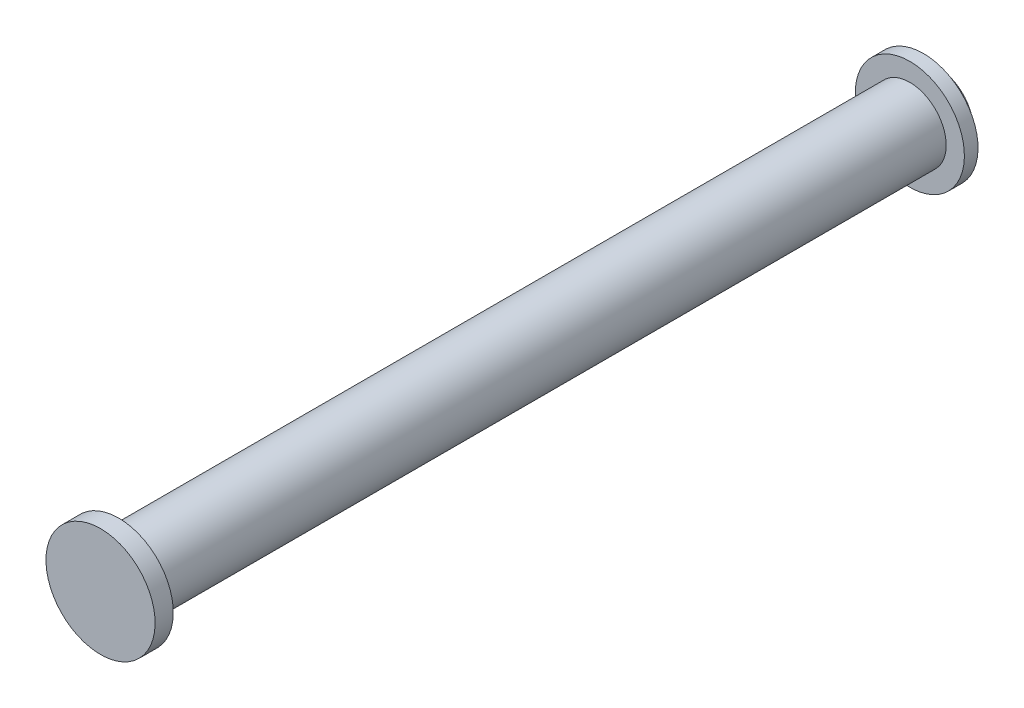
from build123d import *


with BuildPart() as part:
    # Sketch1 → Revolve1 (revolve)
    with BuildSketch(Plane(origin=(0, 0, 0), x_dir=(0, 0, -1), z_dir=(1, 0, 0))):
        Polygon((0, 0), (0, 6), (2, 6), (2, 4), (89, 4), (89, 6), (90.5, 6), (90.5, 4), (92, 4), (92, 0), align=None)
    revolve(axis=Axis((0, 0, -92), (0, 0, 1)))


solid = part.part
